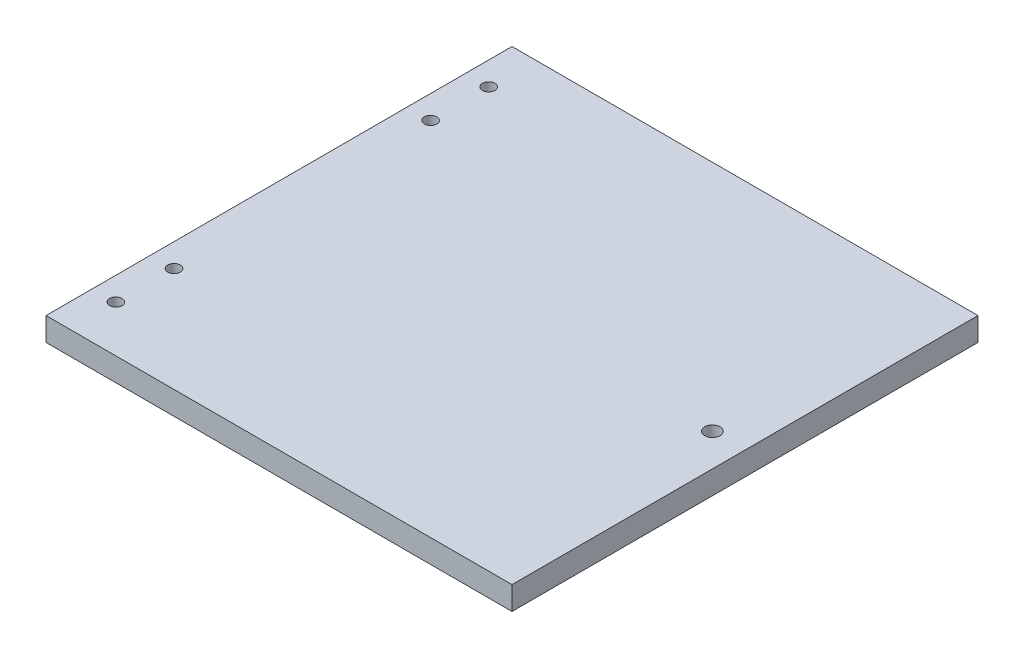
from build123d import *

# Parameters (mm, degrees)
SKETCH1_W           = 127
SKETCH1_H           = 127
SKETCH1_R           = 2.10185
SKETCH1_R_2         = 1.7018
BOSS_EXTRUDE1_DEPTH = 6.35


with BuildPart() as part:
    # Sketch1 → Boss-Extrude1 (new body)
    with BuildSketch(Plane(origin=(0, 0, 0), x_dir=(1, 0, 0), z_dir=(0, 1, 0))):
        with Locations((-29.789985297, -11.505733945)):
            Rectangle(SKETCH1_W, SKETCH1_H)
        with Locations(Location((24.820014703, -11.505733945, 0), (0, 0, 270))):
            Circle(SKETCH1_R, mode=Mode.SUBTRACT)
        with Locations(Location((-86.939985297, 23.457366055, 0), (0, 0, 270))):
            Circle(SKETCH1_R_2, mode=Mode.SUBTRACT)
        with Locations(Location((-86.939985297, 39.294266055, 0), (0, 0, 270))):
            Circle(SKETCH1_R_2, mode=Mode.SUBTRACT)
        with Locations(Location((-86.939985297, -62.305733945, 0), (0, 0, 270))):
            Circle(SKETCH1_R_2, mode=Mode.SUBTRACT)
        with Locations(Location((-86.939985297, -46.468833945, 0), (0, 0, 270))):
            Circle(SKETCH1_R_2, mode=Mode.SUBTRACT)
    extrude(amount=BOSS_EXTRUDE1_DEPTH)


solid = part.part
